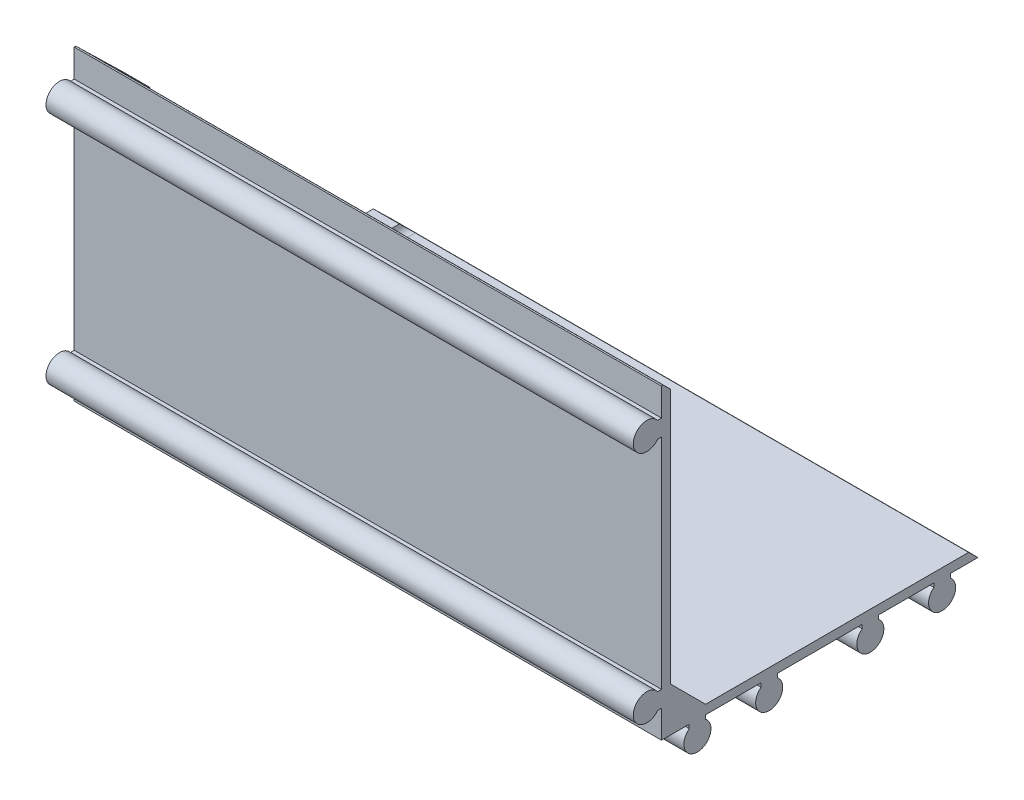
from build123d import *

# Parameters (mm, degrees)
EXTRUDE_1_DEPTH             = 90
SKETCH_2_W                  = 90
SKETCH_2_H                  = 42.75
EXTRUDE_2_DEPTH             = 8.2
SKETCH_3_W                  = 90
SKETCH_3_H                  = 52.45
EXTRUDE_3_DEPTH             = 8.2
SKETCH_4_W                  = 3.95
SKETCH_4_H                  = 2.25
CUT_EXTRUDE_1_DEPTH         = 235.487383722
SKETCH_5_W                  = 3.95
SKETCH_5_H                  = 29.5
CUT_EXTRUDE_2_DEPTH         = 235.487383722
SKETCH_6_W                  = 3.95
SKETCH_6_H                  = 6.2
CUT_EXTRUDE_3_DEPTH         = 235.487383722
SKETCH_7_W                  = 2.25
SKETCH_7_H                  = 3.95
CUT_EXTRUDE_4_DEPTH         = 235.487383722
SKETCH_8_W                  = 4.5
SKETCH_8_H                  = 3.95
CUT_EXTRUDE_5_DEPTH         = 235.487383722
SKETCH_9_W                  = 9
SKETCH_9_H                  = 3.95
CUT_EXTRUDE_6_DEPTH         = 235.487383722
SKETCH_10_W                 = 4.5
SKETCH_10_H                 = 3.95
CUT_EXTRUDE_7_DEPTH         = 235.487383722
SKETCH_11_W                 = 2.25
SKETCH_11_H                 = 3.95
CUT_EXTRUDE_8_DEPTH         = 235.487383722
SKETCH_12_W                 = 45.7
SKETCH_12_H                 = 44.2
CUT_EXTRUDE_9_DEPTH         = 86
HOLE_WIZARD_2_5_2_5_1_D     = 2.5
HOLE_WIZARD_4_5_4_5_1_D     = 4.5
HOLE_WIZARD_8_3_8_3_1_D     = 8.3
HOLE_WIZARD_8_3_8_3_1_DEPTH = 3.2
SKETCH_19_R                 = 1.67252853
SKETCH_19_R_2               = 1.459159852
SKETCH_19_R_3               = 1.459908976
SKETCH_19_R_4               = 1.592821911
SKETCH_19_R_5               = 1.532216665
SKETCH_19_R_6               = 1.596138091
EXTRUDE_4_DEPTH             = 90
CUT_EXTRUDE_START           = -90
SKETCH_20_R                 = 4.15
CUT_EXTRUDE_10_DEPTH        = 90
FILLET_1_R                  = 2
FILLET_2_R                  = 2
FILLET_3_R                  = 2
FILLET_4_R                  = 2
FILLET_5_R                  = 2
FILLET_6_R                  = 2
FILLET_7_R                  = 2
FILLET_8_R                  = 2
FILLET_9_R                  = 2
FILLET_10_R                 = 2
FILLET_11_R                 = 2
FILLET_12_R                 = 2
FILLET_13_R                 = 1.2
CUT_EXTRUDE_11_DEPTH        = 131
EXTRUDE_START               = -4
EXTRUDE_5_DEPTH             = 4
CUT_EXTRUDE_12_DEPTH        = 4
CUT_EXTRUDE_14_DEPTH        = 6
EXTRUDE_6_DEPTH             = 4
EXTRUDE_7_DEPTH             = 87
CUT_EXTRUDE_15_DEPTH        = 84.5


with BuildPart() as part:
    # Эскиз1 → Бобышка-Вытянуть1 (new body)
    with BuildSketch(Plane(origin=(90, 0, 0), x_dir=(0, 0, -1), z_dir=(1, 0, 0))):
        with BuildLine():
            Line((6.75, 160.906238208), (6.75, 204.25))
            Line((6.75, 204.25), (-38.093761792, 204.25))
            ThreePointArc((-38.093761792, 204.25), (-41.825, 203), (-38.093761792, 201.75))
            Line((-38.093761792, 201.75), (-37.5, 201.75))
            Line((-37.5, 201.75), (-37.5, 168.25))
            Line((-37.5, 168.25), (-38.093761792, 168.25))
            ThreePointArc((-38.093761792, 168.25), (-41.825, 167), (-38.093761792, 165.75))
            Line((-38.093761792, 165.75), (-37.5, 165.75))
            Line((-37.5, 165.75), (-37.5, 161.5))
            Line((-37.5, 161.5), (-33.25, 161.5))
            Line((-33.25, 161.5), (-33.25, 160.906238208))
            ThreePointArc((-33.25, 160.906238208), (-32, 157.175), (-30.75, 160.906238208))
            Line((-30.75, 160.906238208), (-30.75, 161.5))
            Line((-30.75, 161.5), (-22.25, 161.5))
            Line((-22.25, 161.5), (-22.25, 160.906238208))
            ThreePointArc((-22.25, 160.906238208), (-21, 157.175), (-19.75, 160.906238208))
            Line((-19.75, 160.906238208), (-19.75, 161.5))
            Line((-19.75, 161.5), (-6.75, 161.5))
            Line((-6.75, 161.5), (-6.75, 160.906238208))
            ThreePointArc((-6.75, 160.906238208), (-5.5, 157.175), (-4.25, 160.906238208))
            Line((-4.25, 160.906238208), (-4.25, 161.5))
            Line((-4.25, 161.5), (4.25, 161.5))
            Line((4.25, 161.5), (4.25, 160.906238208))
            ThreePointArc((4.25, 160.906238208), (5.5, 157.175), (6.75, 160.906238208))
        make_face()
    extrude(amount=-EXTRUDE_1_DEPTH)

    # Эскиз2 → Бобышка-Вытянуть2 (add)
    with BuildSketch(Plane(origin=(0, 0, -6.75), x_dir=(-1, 0, 0), z_dir=(0, 0, -1))):
        with Locations((-45, 182.875)):
            Rectangle(SKETCH_2_W, SKETCH_2_H)
    extrude(amount=EXTRUDE_2_DEPTH)

    # Эскиз3 → Бобышка-Вытянуть3 (add)
    with BuildSketch(Plane(origin=(0, 204.25, 0), x_dir=(-1, 0, 0), z_dir=(0, 1, 0))):
        with Locations((-45, 11.275)):
            Rectangle(SKETCH_3_W, SKETCH_3_H)
    extrude(amount=EXTRUDE_3_DEPTH)

    # Эскиз4 → Вырез-Вытянуть1 (cut, through all)
    with BuildSketch(Plane.ZY):
        with Locations((-12.975, 162.625)):
            Rectangle(SKETCH_4_W, SKETCH_4_H)
    extrude(amount=-CUT_EXTRUDE_1_DEPTH, mode=Mode.SUBTRACT)

    # Эскиз5 → Вырез-Вытянуть2 (cut, through all)
    with BuildSketch(Plane.ZY):
        with Locations((-12.975, 185)):
            Rectangle(SKETCH_5_W, SKETCH_5_H)
    extrude(amount=-CUT_EXTRUDE_2_DEPTH, mode=Mode.SUBTRACT)

    # Эскиз6 → Вырез-Вытянуть3 (cut, through all)
    with BuildSketch(Plane.ZY):
        with Locations((-12.975, 209.35)):
            Rectangle(SKETCH_6_W, SKETCH_6_H)
    extrude(amount=-CUT_EXTRUDE_3_DEPTH, mode=Mode.SUBTRACT)

    # Эскиз7 → Вырез-Вытянуть4 (cut, through all)
    with BuildSketch(Plane.ZY):
        with Locations((-9.875, 210.475)):
            Rectangle(SKETCH_7_W, SKETCH_7_H)
    extrude(amount=-CUT_EXTRUDE_4_DEPTH, mode=Mode.SUBTRACT)

    # Эскиз8 → Вырез-Вытянуть5 (cut, through all)
    with BuildSketch(Plane.ZY):
        with Locations((0, 210.475)):
            Rectangle(SKETCH_8_W, SKETCH_8_H)
    extrude(amount=-CUT_EXTRUDE_5_DEPTH, mode=Mode.SUBTRACT)

    # Эскиз9 → Вырез-Вытянуть6 (cut, through all)
    with BuildSketch(Plane.ZY):
        with Locations((13.25, 210.475)):
            Rectangle(SKETCH_9_W, SKETCH_9_H)
    extrude(amount=-CUT_EXTRUDE_6_DEPTH, mode=Mode.SUBTRACT)

    # Эскиз10 → Вырез-Вытянуть7 (cut, through all)
    with BuildSketch(Plane.ZY):
        with Locations((26.5, 210.475)):
            Rectangle(SKETCH_10_W, SKETCH_10_H)
    extrude(amount=-CUT_EXTRUDE_7_DEPTH, mode=Mode.SUBTRACT)

    # Эскиз11 → Вырез-Вытянуть8 (cut, through all)
    with BuildSketch(Plane.ZY):
        with Locations((36.375, 210.475)):
            Rectangle(SKETCH_11_W, SKETCH_11_H)
    extrude(amount=-CUT_EXTRUDE_8_DEPTH, mode=Mode.SUBTRACT)

    # Эскиз12 → Вырез-Вытянуть9 (cut)
    with BuildSketch(Plane(origin=(90, 0, 0), x_dir=(0, 0, -1), z_dir=(1, 0, 0))):
        with Locations((-13.25, 185)):
            Rectangle(SKETCH_12_W, SKETCH_12_H)
    extrude(amount=-CUT_EXTRUDE_9_DEPTH, mode=Mode.SUBTRACT)

    # Диаметр отверстия Ø2.5 (2.5)1 (through all)
    with Locations(Plane(origin=(90, 0, 0), x_dir=(0, 0, -1), z_dir=(1, 0, 0))):
        with Locations((5.5, 159.25), (-21, 159.25), (-5.5, 159.25), (-32, 159.25), (-39.75, 167), (-39.75, 203)):
            Hole(HOLE_WIZARD_2_5_2_5_1_D / 2)

    # Диаметр отверстия Ø4.5 (4.5)1 (through all)
    with Locations(Plane.ZY):
        with Locations((-13.25, 167), (-13.25, 203), (-5.5, 210.75), (5.5, 210.75), (21, 210.75), (32, 210.75)):
            Hole(HOLE_WIZARD_4_5_4_5_1_D / 2)

    # Диаметр отверстия Ø8.3 (8.3)1
    with Locations(Plane.ZY):
        with Locations((13.25, 185)):
            Hole(HOLE_WIZARD_8_3_8_3_1_D / 2, depth=HOLE_WIZARD_8_3_8_3_1_DEPTH)

    # Эскиз19 → Бобышка-Вытянуть4 (add)
    with BuildSketch(Plane(origin=(90, 0, 0), x_dir=(0, 0, -1), z_dir=(1, 0, 0))):
        with Locations((-39.75, 203)):
            Circle(SKETCH_19_R)
        with Locations((-39.75, 167)):
            Circle(SKETCH_19_R_2)
        with Locations((-32, 159.25)):
            Circle(SKETCH_19_R_3)
        with Locations((-21, 159.25)):
            Circle(SKETCH_19_R_4)
        with Locations((-5.5, 159.25)):
            Circle(SKETCH_19_R_5)
        with Locations((5.5, 159.25)):
            Circle(SKETCH_19_R_6)
    extrude(amount=-EXTRUDE_4_DEPTH)

    # Эскиз20 → Вырез-Вытянуть10 (cut)
    with BuildSketch(Plane.ZY.offset(CUT_EXTRUDE_START)):
        with Locations((13.25, 185)):
            Circle(SKETCH_20_R)
    extrude(amount=CUT_EXTRUDE_10_DEPTH, mode=Mode.SUBTRACT)

    # Скругление1
    fillet_1_edges = [part.edges().sort_by_distance(p)[0] for p in [
        (45, 208.5, -8.75),
    ]]
    fillet(fillet_1_edges, radius=FILLET_1_R)

    # Скругление2
    fillet_2_edges = [part.edges().sort_by_distance(p)[0] for p in [
        (45, 163.75, -11),
    ]]
    fillet(fillet_2_edges, radius=FILLET_2_R)

    # Скругление3
    fillet_3_edges = [part.edges().sort_by_distance(p)[0] for p in [
        (45, 170.25, -11),
    ]]
    fillet(fillet_3_edges, radius=FILLET_3_R)

    # Скругление4
    fillet_4_edges = [part.edges().sort_by_distance(p)[0] for p in [
        (45, 199.75, -11),
    ]]
    fillet(fillet_4_edges, radius=FILLET_4_R)

    # Скругление5
    fillet_5_edges = [part.edges().sort_by_distance(p)[0] for p in [
        (45, 206.25, -11),
    ]]
    fillet(fillet_5_edges, radius=FILLET_5_R)

    # Скругление6
    fillet_6_edges = [part.edges().sort_by_distance(p)[0] for p in [
        (45, 208.5, -2.25),
    ]]
    fillet(fillet_6_edges, radius=FILLET_6_R)

    # Скругление7
    fillet_7_edges = [part.edges().sort_by_distance(p)[0] for p in [
        (45, 208.5, 2.25),
    ]]
    fillet(fillet_7_edges, radius=FILLET_7_R)

    # Скругление8
    fillet_8_edges = [part.edges().sort_by_distance(p)[0] for p in [
        (45, 208.5, 8.75),
    ]]
    fillet(fillet_8_edges, radius=FILLET_8_R)

    # Скругление9
    fillet_9_edges = [part.edges().sort_by_distance(p)[0] for p in [
        (45, 208.5, 17.75),
    ]]
    fillet(fillet_9_edges, radius=FILLET_9_R)

    # Скругление10
    fillet_10_edges = [part.edges().sort_by_distance(p)[0] for p in [
        (45, 208.5, 24.25),
    ]]
    fillet(fillet_10_edges, radius=FILLET_10_R)

    # Скругление11
    fillet_11_edges = [part.edges().sort_by_distance(p)[0] for p in [
        (45, 208.5, 28.75),
    ]]
    fillet(fillet_11_edges, radius=FILLET_11_R)

    # Скругление12
    fillet_12_edges = [part.edges().sort_by_distance(p)[0] for p in [
        (45, 208.5, 35.25),
    ]]
    fillet(fillet_12_edges, radius=FILLET_12_R)

    # Скругление13
    fillet_13_edges = [part.edges().sort_by_distance(p)[0] for p in [
        (4, 185, -9.6),
        (4, 162.9, 13.25),
        (4, 185, 36.1),
        (4, 207.1, 13.25),
    ]]
    fillet(fillet_13_edges, radius=FILLET_13_R)

    # Эскиз21 → Вырез-Вытянуть11 (cut)
    with BuildSketch(Plane(origin=(90, 0, 0), x_dir=(0, 0, -1), z_dir=(1, 0, 0))):
        Polygon((-37.25, 208.5), (11, 161.5), (17.903435656, 161.5), (17.903435656, 214.883320623), (-37.25, 214.883320623), align=None)
    extrude(amount=-CUT_EXTRUDE_11_DEPTH, mode=Mode.SUBTRACT)

    # Эскиз22 → Бобышка-Вытянуть5 (add)
    with BuildSketch(Plane.ZY.offset(EXTRUDE_START)):
        with BuildLine():
            Line((16.161231082, 187.957572246), (10.217049193, 182.167384706))
            ThreePointArc((10.217049193, 182.167384706), (16.145733389, 182.027252425), (16.161231082, 187.957572246))
        make_face()
    extrude(amount=EXTRUDE_5_DEPTH)

    # Эскиз23 → Вырез-Вытянуть12 (cut)
    with BuildSketch(Plane(origin=(4, 0, 0), x_dir=(0, 0, -1), z_dir=(1, 0, 0))):
        Polygon((-29.9, 205.9), (8.330851064, 169.1), (-29.9, 169.1), align=None)
    extrude(amount=-CUT_EXTRUDE_12_DEPTH, mode=Mode.SUBTRACT)

    # Эскиз25 → Вырез-Вытянуть14 (cut)
    with BuildSketch(Plane(origin=(4, 0, 0), x_dir=(0, 0, -1), z_dir=(1, 0, 0))):
        Polygon((-29.9, 164.1), (8.330851064, 164.1), (3.19787234, 169.1), (-29.9, 169.1), align=None)
    extrude(amount=-CUT_EXTRUDE_14_DEPTH, mode=Mode.SUBTRACT)

    # Эскиз26 → Бобышка-Вытянуть6 (add)
    with BuildSketch(Plane(origin=(4, 0, 0), x_dir=(0, 0, -1), z_dir=(1, 0, 0))):
        Polygon((-29.9, 184.1), (-19.75, 164.1), (-29.9, 164.1), align=None)
    extrude(amount=-EXTRUDE_6_DEPTH)

    # Эскиз27 → Бобышка-Вытянуть7 (add)
    with BuildSketch(Plane(origin=(90, 0, 0), x_dir=(0, 0, -1), z_dir=(1, 0, 0))):
        Polygon((-30.75, 162.9), (-36.1, 162.9), (-36.1, 168.25), align=None)
    extrude(amount=-EXTRUDE_7_DEPTH)

    # Эскиз28 → Вырез-Вытянуть15 (cut)
    with BuildSketch(Plane(origin=(90, 0, 0), x_dir=(0, 0, -1), z_dir=(1, 0, 0))):
        Polygon((-36.1, 207.1), (-35.812765957, 207.1), (-36.1, 207.379792746), align=None)
    extrude(amount=-CUT_EXTRUDE_15_DEPTH, mode=Mode.SUBTRACT)


solid = part.part
